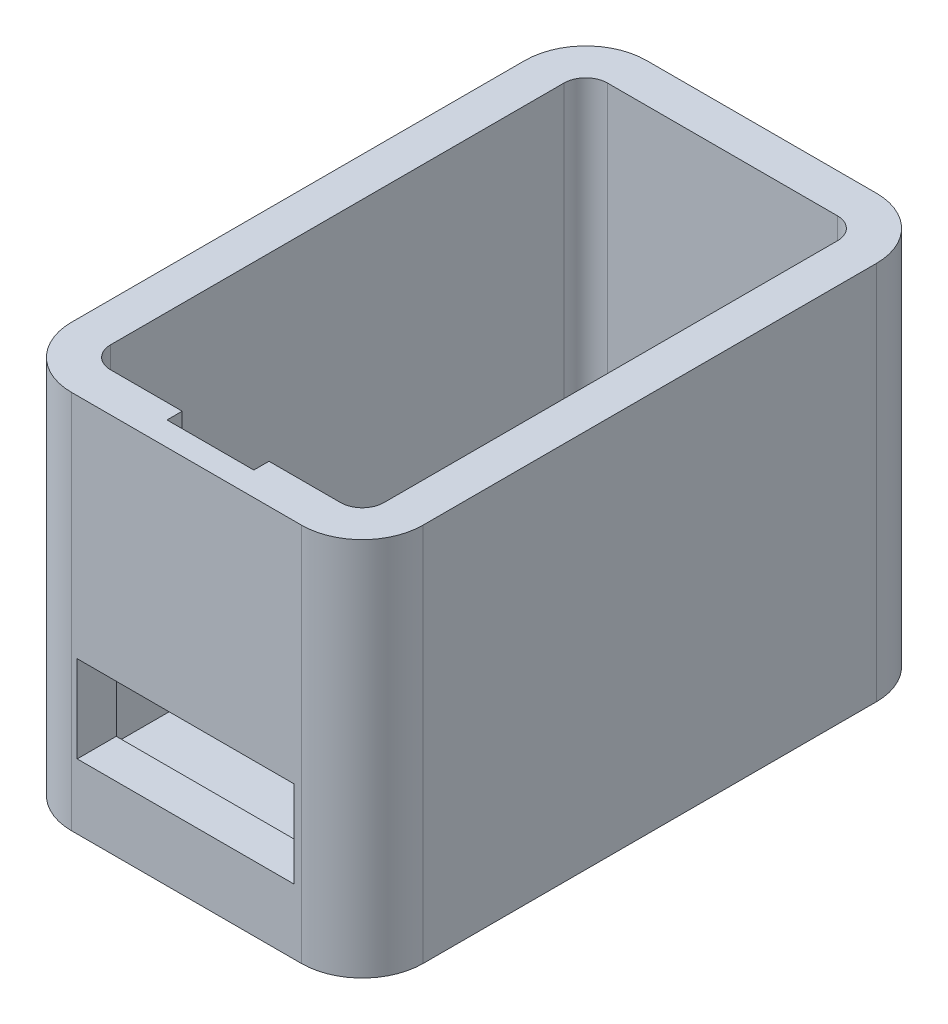
from build123d import *

# Parameters (mm, degrees)
BOSS_EXTRUDE1_DEPTH = 16
BOSS_EXTRUDE2_START = 1.5
BOSS_EXTRUDE2_DEPTH = 1.5
SKETCH3_W           = 10
SKETCH3_H           = 4
CUT_EXTRUDE1_DEPTH  = 2.5
SKETCH5_W           = 4
SKETCH5_H           = 1.4
CUT_EXTRUDE2_DEPTH  = 14


with BuildPart() as part:
    # Sketch1 → Boss-Extrude1 (new body)
    with BuildSketch(Plane(origin=(0, 0, 0), x_dir=(1, 0, 0), z_dir=(0, 1, 0))):
        with BuildLine():
            Line((-5.25, 13.3), (5.35, 13.3))
            ThreePointArc((5.35, 13.3), (7.329898987, 12.479898987), (8.15, 10.5))
            Line((8.15, 10.5), (8.15, -10.4))
            ThreePointArc((8.15, -10.4), (7.329898987, -12.379898987), (5.35, -13.2))
            Line((5.35, -13.2), (-5.25, -13.2))
            ThreePointArc((-5.25, -13.2), (-7.229898987, -12.379898987), (-8.05, -10.4))
            Line((-8.05, -10.4), (-8.05, 10.5))
            ThreePointArc((-8.05, 10.5), (-7.229898987, 12.479898987), (-5.25, 13.3))
        make_face()
        with BuildLine():
            Line((-5.25, 11.5), (5.35, 11.5))
            ThreePointArc((5.35, 11.5), (6.057106781, 11.207106781), (6.35, 10.5))
            Line((6.35, 10.5), (6.35, -10.4))
            ThreePointArc((6.35, -10.4), (6.057106781, -11.107106781), (5.35, -11.4))
            Line((5.35, -11.4), (-5.25, -11.4))
            ThreePointArc((-5.25, -11.4), (-5.957106781, -11.107106781), (-6.25, -10.4))
            Line((-6.25, -10.4), (-6.25, 10.5))
            ThreePointArc((-6.25, 10.5), (-5.957106781, 11.207106781), (-5.25, 11.5))
        make_face(mode=Mode.SUBTRACT)
    extrude(amount=BOSS_EXTRUDE1_DEPTH)

    # Sketch2 → Boss-Extrude2 (add)
    with BuildSketch(Plane.XZ.offset(BOSS_EXTRUDE2_START)):
        with BuildLine():
            Line((-5.25, 13.2), (5.35, 13.2))
            ThreePointArc((5.35, 13.2), (7.329898987, 12.379898987), (8.15, 10.4))
            Line((8.15, 10.4), (8.15, -10.5))
            ThreePointArc((8.15, -10.5), (7.329898987, -12.479898987), (5.35, -13.3))
            Line((5.35, -13.3), (-5.25, -13.3))
            ThreePointArc((-5.25, -13.3), (-7.229898987, -12.479898987), (-8.05, -10.5))
            Line((-8.05, -10.5), (-8.05, 10.4))
            ThreePointArc((-8.05, 10.4), (-7.229898987, 12.379898987), (-5.25, 13.2))
        make_face()
    extrude(amount=-BOSS_EXTRUDE2_DEPTH)

    # Sketch3 → Cut-Extrude1 (cut)
    with BuildSketch(Plane.XY.offset(13.2)):
        with Locations((0.0109375, 3.5)):
            Rectangle(SKETCH3_W, SKETCH3_H)
    extrude(amount=-CUT_EXTRUDE1_DEPTH, mode=Mode.SUBTRACT)

    # Sketch5 → Cut-Extrude2 (cut)
    with BuildSketch(Plane(origin=(0, 16, 0), x_dir=(1, 0, 0), z_dir=(0, 1, 0))):
        with Locations((0.05, -11.4)):
            Rectangle(SKETCH5_W, SKETCH5_H)
    extrude(amount=-CUT_EXTRUDE2_DEPTH, mode=Mode.SUBTRACT)


solid = part.part
